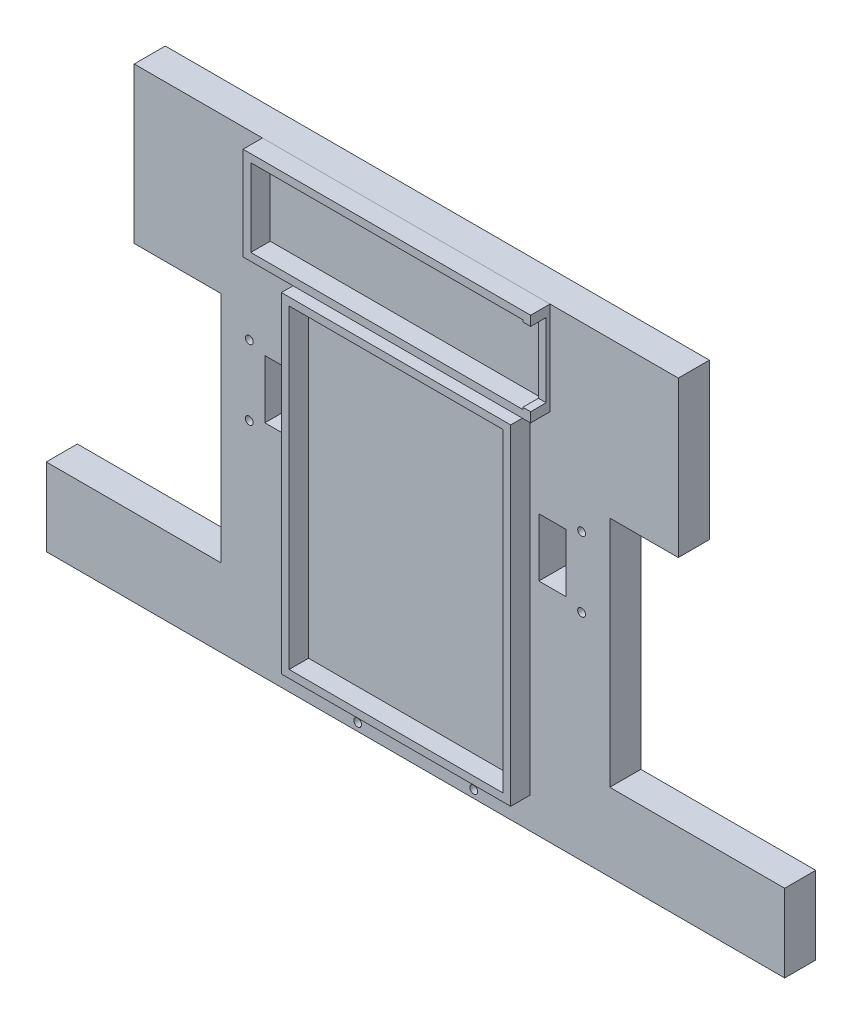
from build123d import *

# Parameters (mm, degrees)
RESSALTO_EXTRUS_O1_DEPTH = 8
ESBO_O2_W                = 59
ESBO_O2_H                = 85
ESBO_O2_W_2              = 55
ESBO_O2_H_2              = 81
RESSALTO_EXTRUS_O2_DEPTH = 5
ESBO_O3_R                = 1
CORTE_EXTRUS_O1_DEPTH    = 161.48856651
ESBO_O5_W                = 74
ESBO_O5_H                = 24
ESBO_O5_W_2              = 70
ESBO_O5_H_2              = 20
RESSALTO_EXTRUS_O4_DEPTH = 5
ESBO_O6_W                = 2
ESBO_O6_H                = 19
CORTE_EXTRUS_O2_DEPTH    = 4
ESBO_O7_R                = 1
ESBO_O7_W                = 7
ESBO_O7_H                = 15
CORTE_EXTRUS_O4_DEPTH    = 161.490657476


with BuildPart() as part:
    # Esboço1 → Ressalto-extrusão1 (new body)
    with BuildSketch(Plane.XY):
        Polygon((39.408169461, 102.513026677), (39.408169461, 62.513026677), (21.778007881, 62.513026677), (21.778007881, 2.513026677), (66.778007881, 2.513026677), (66.778007881, -17.486973323), (-123.221992119, -17.486973323), (-123.221992119, 2.513026677), (-78.221992119, 2.513026677), (-78.221992119, 62.513026677), (-100.591830539, 62.513026677), (-100.591830539, 102.513026677), align=None)
    extrude(amount=RESSALTO_EXTRUS_O1_DEPTH)

    # Esboço2 → Ressalto-extrusão2 (add)
    with BuildSketch(Plane.XY.offset(8)):
        with Locations((-28.221992119, 33.013026677)):
            Rectangle(ESBO_O2_W, ESBO_O2_H)
        with Locations((-28.221992119, 33.013026677)):
            Rectangle(ESBO_O2_W_2, ESBO_O2_H_2, mode=Mode.SUBTRACT)
    extrude(amount=RESSALTO_EXTRUS_O2_DEPTH)

    # Esboço3 → Corte-extrusão1 (cut, through all)
    with BuildSketch(Plane.XY.offset(8)):
        with Locations((-13.221992119, -15.486973323)):
            Circle(ESBO_O3_R)
        with Locations((-43.099997489, -15.486973323)):
            Circle(ESBO_O3_R)
    extrude(amount=-CORTE_EXTRUS_O1_DEPTH, mode=Mode.SUBTRACT)

    # Esboço5 → Ressalto-extrusão4 (add)
    with BuildSketch(Plane.XY.offset(8)):
        with Locations((-30.591830539, 90.516300144)):
            Rectangle(ESBO_O5_W, ESBO_O5_H)
        with Locations((-30.591830539, 90.516300144)):
            Rectangle(ESBO_O5_W_2, ESBO_O5_H_2, mode=Mode.SUBTRACT)
    extrude(amount=RESSALTO_EXTRUS_O4_DEPTH)

    # Esboço6 → Corte-extrusão2 (cut)
    with BuildSketch(Plane.XY.offset(13)):
        with Locations((5.408169461, 90.516300144)):
            Rectangle(ESBO_O6_W, ESBO_O6_H)
    extrude(amount=-CORTE_EXTRUS_O2_DEPTH, mode=Mode.SUBTRACT)

    # Esboço7 → Corte-extrusão4 (cut, through all)
    with BuildSketch(Plane.XY.offset(8)):
        with Locations((-70.971992119, 55.851364498)):
            Circle(ESBO_O7_R)
        with Locations((14.528007881, 37.851364498)):
            Circle(ESBO_O7_R)
        with Locations((7.028007881, 46.851364498)):
            Rectangle(ESBO_O7_W, ESBO_O7_H)
        with Locations((14.528007881, 55.851364498)):
            Circle(ESBO_O7_R)
        with Locations((-63.471992119, 46.851364498)):
            Rectangle(ESBO_O7_W, ESBO_O7_H)
        with Locations((-70.971992119, 37.851364498)):
            Circle(ESBO_O7_R)
    extrude(amount=-CORTE_EXTRUS_O4_DEPTH, mode=Mode.SUBTRACT)


solid = part.part
